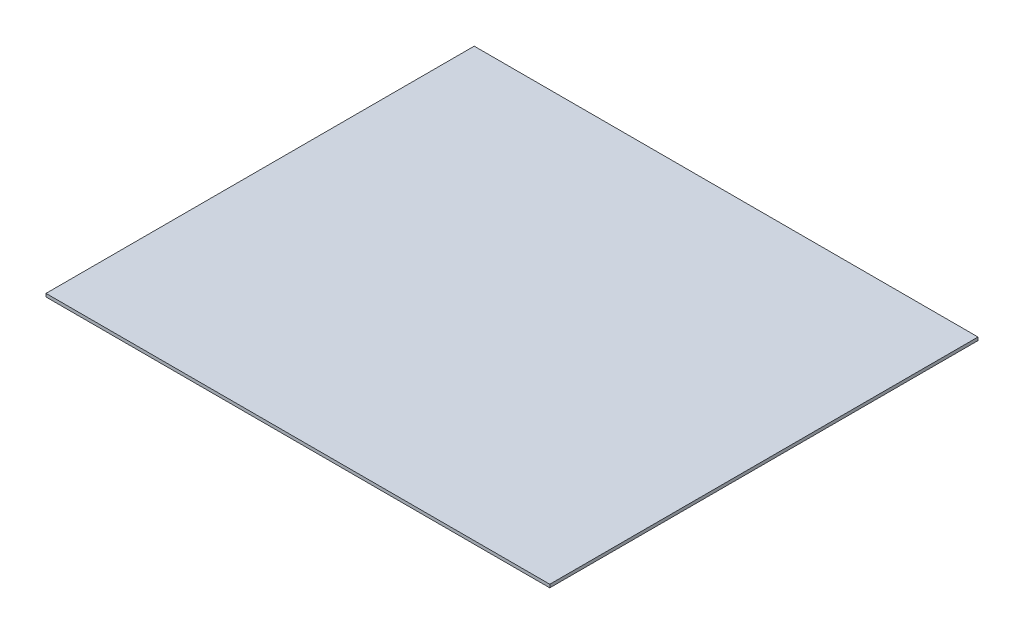
from build123d import *

# Parameters (mm, degrees)
SKETCH1_W           = 762
SKETCH1_H           = 647.7
BOSS_EXTRUDE1_DEPTH = 4.7625


with BuildPart() as part:
    # Sketch1 → Boss-Extrude1 (new body)
    with BuildSketch(Plane(origin=(0, 0, 0), x_dir=(1, 0, 0), z_dir=(0, 1, 0))):
        Rectangle(SKETCH1_W, SKETCH1_H)
    extrude(amount=BOSS_EXTRUDE1_DEPTH)


solid = part.part
